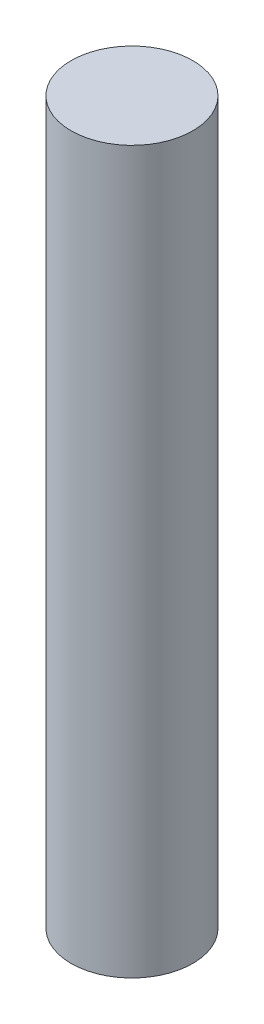
from build123d import *

# Parameters (mm, degrees)
SKETCH2_R = 6.75


with BuildPart() as part:
    # Sweep1: sweep along a path in Sketch1
    with BuildLine(Plane.XY) as sweep1_path:
        Line((0, 0), (0, 80))
    # Sketch2 → Sweep1 (sweep)
    with BuildSketch(Plane(origin=(0, 0, 0), x_dir=(1, 0, 0), z_dir=(0, 1, 0))):
        Circle(SKETCH2_R)
    sweep(path=sweep1_path.line)


solid = part.part
